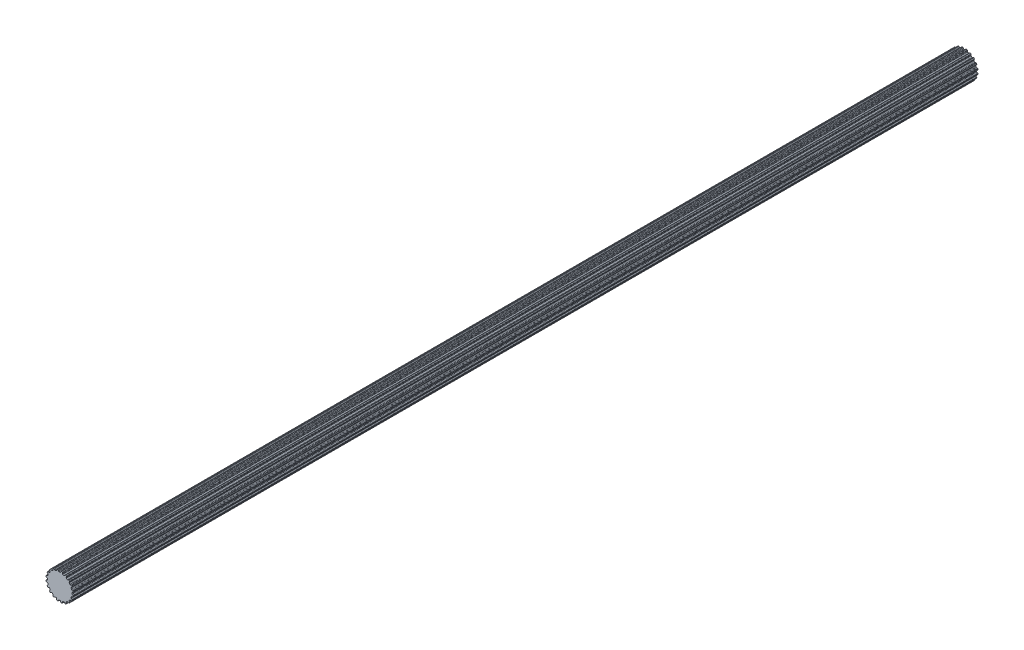
from build123d import *

# Parameters (mm, degrees)
BOSS_EXTRUDE1_DEPTH = 110.363


with BuildPart() as part:
    # Sketch1 → Boss-Extrude1 (new, symmetric)
    with BuildSketch(Plane.XY):
        with BuildLine():
            Line((-0.106949245, 2.969874934), (0.106949245, 2.969874934))
            ThreePointArc((0.106949245, 2.969874934), (0.196343213, 2.986924176), (0.253739238, 3.057547504))
            Line((0.253739238, 3.057547504), (0.315888147, 3.237526941))
            ThreePointArc((0.315888147, 3.237526941), (0.359032156, 3.298322911), (0.4281449, 3.326269005))
            Line((0.4281449, 3.326269005), (0.620027588, 3.2937547))
            ThreePointArc((0.620027588, 3.2937547), (0.689621142, 3.24802576), (0.718272212, 3.169836791))
            Line((0.718272212, 3.169836791), (0.724389167, 2.979527391))
            ThreePointArc((0.724389167, 2.979527391), (0.750934762, 2.9040661), (0.816027049, 2.857568043))
            Line((0.816027049, 2.857568043), (1.019456602, 2.791469774))
            ThreePointArc((1.019456602, 2.791469774), (1.109743823, 2.780060312), (1.186154496, 2.829490741))
            Line((1.186154496, 2.829490741), (1.300878326, 2.981456288))
            ThreePointArc((1.300878326, 2.981456288), (1.360697704, 3.02594446), (1.435063648, 3.031165762))
            Line((1.435063648, 3.031165762), (1.607507455, 2.940947809))
            ThreePointArc((1.607507455, 2.940947809), (1.659563839, 2.875951412), (1.662650905, 2.792735615))
            Line((1.662650905, 2.792735615), (1.609659636, 2.609850378))
            ThreePointArc((1.609659636, 2.609850378), (1.611587176, 2.529879385), (1.659124931, 2.465542482))
            Line((1.659124931, 2.465542482), (1.832172444, 2.339816104))
            ThreePointArc((1.832172444, 2.339816104), (1.914514976, 2.301064775), (2.002460687, 2.32446371))
            Line((2.002460687, 2.32446371), (2.158529469, 2.433539921))
            ThreePointArc((2.158529469, 2.433539921), (2.229168681, 2.457365482), (2.301508367, 2.439350895))
            Line((2.301508367, 2.439350895), (2.437633293, 2.300260456))
            ThreePointArc((2.437633293, 2.300260456), (2.467056864, 2.222358901), (2.444277744, 2.14226202))
            Line((2.444277744, 2.14226202), (2.337365406, 1.984703026))
            ThreePointArc((2.337365406, 1.984703026), (2.314486209, 1.908050449), (2.339816104, 1.832172444))
            Line((2.339816104, 1.832172444), (2.465542482, 1.659124931))
            ThreePointArc((2.465542482, 1.659124931), (2.531880064, 1.596824985), (2.622752074, 1.591901975))
            Line((2.622752074, 1.591901975), (2.804888709, 1.64741171))
            ThreePointArc((2.804888709, 1.64741171), (2.879433095, 1.648242449), (2.942665411, 1.608755366))
            Line((2.942665411, 1.608755366), (3.0291466, 1.434407582))
            ThreePointArc((3.0291466, 1.434407582), (3.033057175, 1.351226417), (2.986641646, 1.282088892))
            Line((2.986641646, 1.282088892), (2.836273564, 1.165279113))
            ThreePointArc((2.836273564, 1.165279113), (2.790827206, 1.099448241), (2.791469774, 1.019456602))
            Line((2.791469774, 1.019456602), (2.857568043, 0.816027049))
            ThreePointArc((2.857568043, 0.816027049), (2.901407091, 0.736276839), (2.986310214, 0.703513784))
            Line((2.986310214, 0.703513784), (3.1766859, 0.700023363))
            ThreePointArc((3.1766859, 0.700023363), (3.247838536, 0.677777961), (3.295773863, 0.620683653))
            Line((3.295773863, 0.620683653), (3.324145932, 0.4281449))
            ThreePointArc((3.324145932, 0.4281449), (3.302160717, 0.347826477), (3.236652255, 0.29641597))
            Line((3.236652255, 0.29641597), (3.057547504, 0.231789562))
            ThreePointArc((3.057547504, 0.231789562), (2.993982591, 0.183224379), (2.969874934, 0.106949245))
            Line((2.969874934, 0.106949245), (2.969874934, -0.106949245))
            ThreePointArc((2.969874934, -0.106949245), (2.986924176, -0.196343213), (3.057547504, -0.253739238))
            Line((3.057547504, -0.253739238), (3.237526941, -0.315888147))
            ThreePointArc((3.237526941, -0.315888147), (3.298322911, -0.359032156), (3.326269005, -0.4281449))
            Line((3.326269005, -0.4281449), (3.2937547, -0.620027588))
            ThreePointArc((3.2937547, -0.620027588), (3.24802576, -0.689621142), (3.169836791, -0.718272212))
            Line((3.169836791, -0.718272212), (2.979527391, -0.724389167))
            ThreePointArc((2.979527391, -0.724389167), (2.9040661, -0.750934762), (2.857568043, -0.816027049))
            Line((2.857568043, -0.816027049), (2.791469774, -1.019456602))
            ThreePointArc((2.791469774, -1.019456602), (2.780060312, -1.109743823), (2.829490741, -1.186154496))
            Line((2.829490741, -1.186154496), (2.981456288, -1.300878326))
            ThreePointArc((2.981456288, -1.300878326), (3.02594446, -1.360697704), (3.031165762, -1.435063648))
            Line((3.031165762, -1.435063648), (2.940947809, -1.607507455))
            ThreePointArc((2.940947809, -1.607507455), (2.875951412, -1.659563839), (2.792735615, -1.662650905))
            Line((2.792735615, -1.662650905), (2.609850378, -1.609659636))
            ThreePointArc((2.609850378, -1.609659636), (2.529879385, -1.611587176), (2.465542482, -1.659124931))
            Line((2.465542482, -1.659124931), (2.339816104, -1.832172444))
            ThreePointArc((2.339816104, -1.832172444), (2.301064775, -1.914514976), (2.32446371, -2.002460687))
            Line((2.32446371, -2.002460687), (2.433539921, -2.158529469))
            ThreePointArc((2.433539921, -2.158529469), (2.457365482, -2.229168681), (2.439350895, -2.301508367))
            Line((2.439350895, -2.301508367), (2.300260456, -2.437633293))
            ThreePointArc((2.300260456, -2.437633293), (2.222358901, -2.467056864), (2.14226202, -2.444277744))
            Line((2.14226202, -2.444277744), (1.984703026, -2.337365406))
            ThreePointArc((1.984703026, -2.337365406), (1.908050449, -2.314486209), (1.832172444, -2.339816104))
            Line((1.832172444, -2.339816104), (1.659124931, -2.465542482))
            ThreePointArc((1.659124931, -2.465542482), (1.596824985, -2.531880064), (1.591901975, -2.622752074))
            Line((1.591901975, -2.622752074), (1.64741171, -2.804888709))
            ThreePointArc((1.64741171, -2.804888709), (1.648242449, -2.879433095), (1.608755366, -2.942665411))
            Line((1.608755366, -2.942665411), (1.434407582, -3.0291466))
            ThreePointArc((1.434407582, -3.0291466), (1.351226417, -3.033057175), (1.282088892, -2.986641646))
            Line((1.282088892, -2.986641646), (1.165279113, -2.836273564))
            ThreePointArc((1.165279113, -2.836273564), (1.099448241, -2.790827206), (1.019456602, -2.791469774))
            Line((1.019456602, -2.791469774), (0.816027049, -2.857568043))
            ThreePointArc((0.816027049, -2.857568043), (0.736276839, -2.901407091), (0.703513784, -2.986310214))
            Line((0.703513784, -2.986310214), (0.700023363, -3.1766859))
            ThreePointArc((0.700023363, -3.1766859), (0.677777961, -3.247838536), (0.620683653, -3.295773863))
            Line((0.620683653, -3.295773863), (0.4281449, -3.324145932))
            ThreePointArc((0.4281449, -3.324145932), (0.347826477, -3.302160717), (0.29641597, -3.236652255))
            Line((0.29641597, -3.236652255), (0.231789562, -3.057547504))
            ThreePointArc((0.231789562, -3.057547504), (0.183224379, -2.993982591), (0.106949245, -2.969874934))
            Line((0.106949245, -2.969874934), (-0.106949245, -2.969874934))
            ThreePointArc((-0.106949245, -2.969874934), (-0.196343213, -2.986924176), (-0.253739238, -3.057547504))
            Line((-0.253739238, -3.057547504), (-0.315888147, -3.237526941))
            ThreePointArc((-0.315888147, -3.237526941), (-0.359032156, -3.298322911), (-0.4281449, -3.326269005))
            Line((-0.4281449, -3.326269005), (-0.620027588, -3.2937547))
            ThreePointArc((-0.620027588, -3.2937547), (-0.689621142, -3.24802576), (-0.718272212, -3.169836791))
            Line((-0.718272212, -3.169836791), (-0.724389167, -2.979527391))
            ThreePointArc((-0.724389167, -2.979527391), (-0.750934762, -2.9040661), (-0.816027049, -2.857568043))
            Line((-0.816027049, -2.857568043), (-1.019456602, -2.791469774))
            ThreePointArc((-1.019456602, -2.791469774), (-1.109743823, -2.780060312), (-1.186154496, -2.829490741))
            Line((-1.186154496, -2.829490741), (-1.300878326, -2.981456288))
            ThreePointArc((-1.300878326, -2.981456288), (-1.360697704, -3.02594446), (-1.435063648, -3.031165762))
            Line((-1.435063648, -3.031165762), (-1.607507455, -2.940947809))
            ThreePointArc((-1.607507455, -2.940947809), (-1.659563839, -2.875951412), (-1.662650905, -2.792735615))
            Line((-1.662650905, -2.792735615), (-1.609659636, -2.609850378))
            ThreePointArc((-1.609659636, -2.609850378), (-1.611587176, -2.529879385), (-1.659124931, -2.465542482))
            Line((-1.659124931, -2.465542482), (-1.832172444, -2.339816104))
            ThreePointArc((-1.832172444, -2.339816104), (-1.914514976, -2.301064775), (-2.002460687, -2.32446371))
            Line((-2.002460687, -2.32446371), (-2.158529469, -2.433539921))
            ThreePointArc((-2.158529469, -2.433539921), (-2.229168681, -2.457365482), (-2.301508367, -2.439350895))
            Line((-2.301508367, -2.439350895), (-2.437633293, -2.300260456))
            ThreePointArc((-2.437633293, -2.300260456), (-2.467056864, -2.222358901), (-2.444277744, -2.14226202))
            Line((-2.444277744, -2.14226202), (-2.337365406, -1.984703026))
            ThreePointArc((-2.337365406, -1.984703026), (-2.314486209, -1.908050449), (-2.339816104, -1.832172444))
            Line((-2.339816104, -1.832172444), (-2.465542482, -1.659124931))
            ThreePointArc((-2.465542482, -1.659124931), (-2.531880064, -1.596824985), (-2.622752074, -1.591901975))
            Line((-2.622752074, -1.591901975), (-2.804888709, -1.64741171))
            ThreePointArc((-2.804888709, -1.64741171), (-2.879433095, -1.648242449), (-2.942665411, -1.608755366))
            Line((-2.942665411, -1.608755366), (-3.0291466, -1.434407582))
            ThreePointArc((-3.0291466, -1.434407582), (-3.033057175, -1.351226417), (-2.986641646, -1.282088892))
            Line((-2.986641646, -1.282088892), (-2.836273564, -1.165279113))
            ThreePointArc((-2.836273564, -1.165279113), (-2.790827206, -1.099448241), (-2.791469774, -1.019456602))
            Line((-2.791469774, -1.019456602), (-2.857568043, -0.816027049))
            ThreePointArc((-2.857568043, -0.816027049), (-2.901407091, -0.736276839), (-2.986310214, -0.703513784))
            Line((-2.986310214, -0.703513784), (-3.1766859, -0.700023363))
            ThreePointArc((-3.1766859, -0.700023363), (-3.247838536, -0.677777961), (-3.295773863, -0.620683653))
            Line((-3.295773863, -0.620683653), (-3.324145932, -0.4281449))
            ThreePointArc((-3.324145932, -0.4281449), (-3.302160717, -0.347826477), (-3.236652255, -0.29641597))
            Line((-3.236652255, -0.29641597), (-3.057547504, -0.231789562))
            ThreePointArc((-3.057547504, -0.231789562), (-2.993982591, -0.183224379), (-2.969874934, -0.106949245))
            Line((-2.969874934, -0.106949245), (-2.969874934, 0.106949245))
            ThreePointArc((-2.969874934, 0.106949245), (-2.986924176, 0.196343213), (-3.057547504, 0.253739238))
            Line((-3.057547504, 0.253739238), (-3.237526941, 0.315888147))
            ThreePointArc((-3.237526941, 0.315888147), (-3.298322911, 0.359032156), (-3.326269005, 0.4281449))
            Line((-3.326269005, 0.4281449), (-3.2937547, 0.620027588))
            ThreePointArc((-3.2937547, 0.620027588), (-3.24802576, 0.689621142), (-3.169836791, 0.718272212))
            Line((-3.169836791, 0.718272212), (-2.979527391, 0.724389167))
            ThreePointArc((-2.979527391, 0.724389167), (-2.9040661, 0.750934762), (-2.857568043, 0.816027049))
            Line((-2.857568043, 0.816027049), (-2.791469774, 1.019456602))
            ThreePointArc((-2.791469774, 1.019456602), (-2.780060312, 1.109743823), (-2.829490741, 1.186154496))
            Line((-2.829490741, 1.186154496), (-2.981456288, 1.300878326))
            ThreePointArc((-2.981456288, 1.300878326), (-3.02594446, 1.360697704), (-3.031165762, 1.435063648))
            Line((-3.031165762, 1.435063648), (-2.940947809, 1.607507455))
            ThreePointArc((-2.940947809, 1.607507455), (-2.875951412, 1.659563839), (-2.792735615, 1.662650905))
            Line((-2.792735615, 1.662650905), (-2.609850378, 1.609659636))
            ThreePointArc((-2.609850378, 1.609659636), (-2.529879385, 1.611587176), (-2.465542482, 1.659124931))
            Line((-2.465542482, 1.659124931), (-2.339816104, 1.832172444))
            ThreePointArc((-2.339816104, 1.832172444), (-2.301064775, 1.914514976), (-2.32446371, 2.002460687))
            Line((-2.32446371, 2.002460687), (-2.433539921, 2.158529469))
            ThreePointArc((-2.433539921, 2.158529469), (-2.457365482, 2.229168681), (-2.439350895, 2.301508367))
            Line((-2.439350895, 2.301508367), (-2.300260456, 2.437633293))
            ThreePointArc((-2.300260456, 2.437633293), (-2.222358901, 2.467056864), (-2.14226202, 2.444277744))
            Line((-2.14226202, 2.444277744), (-1.984703026, 2.337365406))
            ThreePointArc((-1.984703026, 2.337365406), (-1.908050449, 2.314486209), (-1.832172444, 2.339816104))
            Line((-1.832172444, 2.339816104), (-1.659124931, 2.465542482))
            ThreePointArc((-1.659124931, 2.465542482), (-1.596824985, 2.531880064), (-1.591901975, 2.622752074))
            Line((-1.591901975, 2.622752074), (-1.64741171, 2.804888709))
            ThreePointArc((-1.64741171, 2.804888709), (-1.648242449, 2.879433095), (-1.608755366, 2.942665411))
            Line((-1.608755366, 2.942665411), (-1.434407582, 3.0291466))
            ThreePointArc((-1.434407582, 3.0291466), (-1.351226417, 3.033057175), (-1.282088892, 2.986641646))
            Line((-1.282088892, 2.986641646), (-1.165279113, 2.836273564))
            ThreePointArc((-1.165279113, 2.836273564), (-1.099448241, 2.790827206), (-1.019456602, 2.791469774))
            Line((-1.019456602, 2.791469774), (-0.816027049, 2.857568043))
            ThreePointArc((-0.816027049, 2.857568043), (-0.736276839, 2.901407091), (-0.703513784, 2.986310214))
            Line((-0.703513784, 2.986310214), (-0.700023363, 3.1766859))
            ThreePointArc((-0.700023363, 3.1766859), (-0.677777961, 3.247838536), (-0.620683653, 3.295773863))
            Line((-0.620683653, 3.295773863), (-0.4281449, 3.324145932))
            ThreePointArc((-0.4281449, 3.324145932), (-0.347826477, 3.302160717), (-0.29641597, 3.236652255))
            Line((-0.29641597, 3.236652255), (-0.231789562, 3.057547504))
            ThreePointArc((-0.231789562, 3.057547504), (-0.183224379, 2.993982591), (-0.106949245, 2.969874934))
        make_face()
    extrude(amount=BOSS_EXTRUDE1_DEPTH, both=True)


solid = part.part
